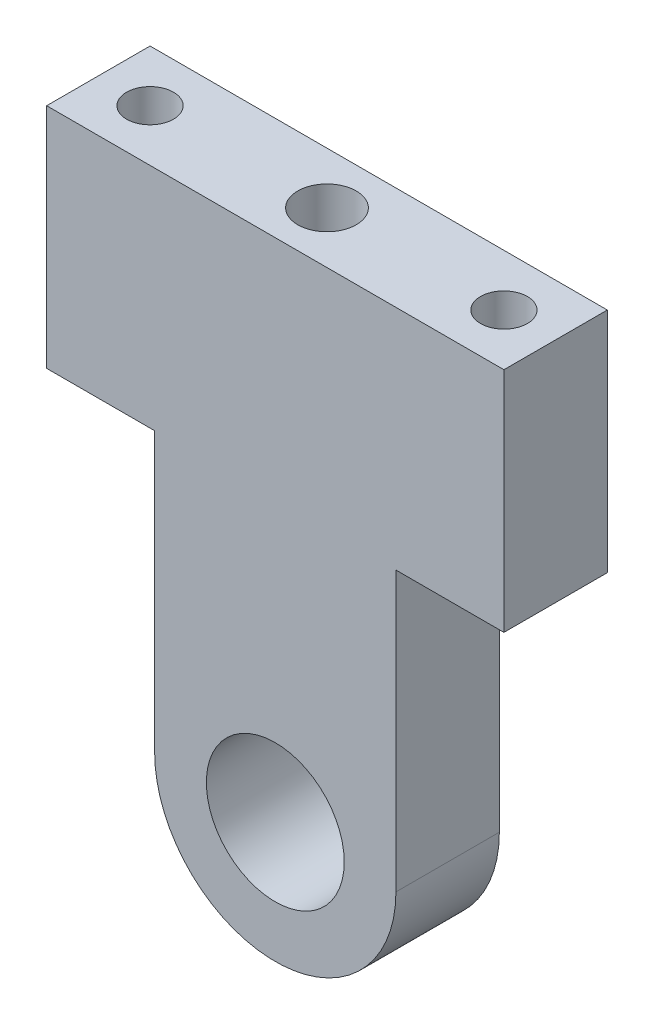
from build123d import *

# Parameters (mm, degrees)
SKETCH1_R           = 10
BOSS_EXTRUDE1_DEPTH = 15
SKETCH2_R           = 3.4
CUT_EXTRUDE1_DEPTH  = 54
SKETCH3_R           = 4.25
CUT_EXTRUDE2_DEPTH  = 28


with BuildPart() as part:
    # Sketch1 → Boss-Extrude1 (new body)
    with BuildSketch(Plane.XY):
        with BuildLine():
            Line((0, 0), (0, 33))
            Line((0, 33), (66.33, 33))
            Line((66.33, 33), (66.33, 0))
            Line((66.33, 0), (50.665, 0))
            Line((50.665, 0), (50.665, -40.433566532))
            ThreePointArc((50.665, -40.433566532), (33.165, -57.933566532), (15.665, -40.433566532))
            Line((15.665, -40.433566532), (15.665, 0))
            Line((15.665, 0), (0, 0))
        make_face()
        with Locations((33.165, -40.433566532)):
            Circle(SKETCH1_R, mode=Mode.SUBTRACT)
    extrude(amount=BOSS_EXTRUDE1_DEPTH)

    # Sketch2 → Cut-Extrude1 (cut)
    with BuildSketch(Plane(origin=(0, 33, 0), x_dir=(1, 0, 0), z_dir=(0, 1, 0))):
        with Locations(Location((58.831, -7.5, 0), (0, 0, 270))):
            Circle(SKETCH2_R)
        with Locations(Location((7.499, -7.5, 0), (0, 0, 180))):
            Circle(SKETCH2_R)
    extrude(amount=-CUT_EXTRUDE1_DEPTH, mode=Mode.SUBTRACT)

    # Sketch3 → Cut-Extrude2 (cut)
    with BuildSketch(Plane(origin=(0, 33, 0), x_dir=(1, 0, 0), z_dir=(0, 1, 0))):
        with Locations(Location((33.165, -7.5, 0), (0, 0, 270))):
            Circle(SKETCH3_R)
    extrude(amount=-CUT_EXTRUDE2_DEPTH, mode=Mode.SUBTRACT)


solid = part.part
